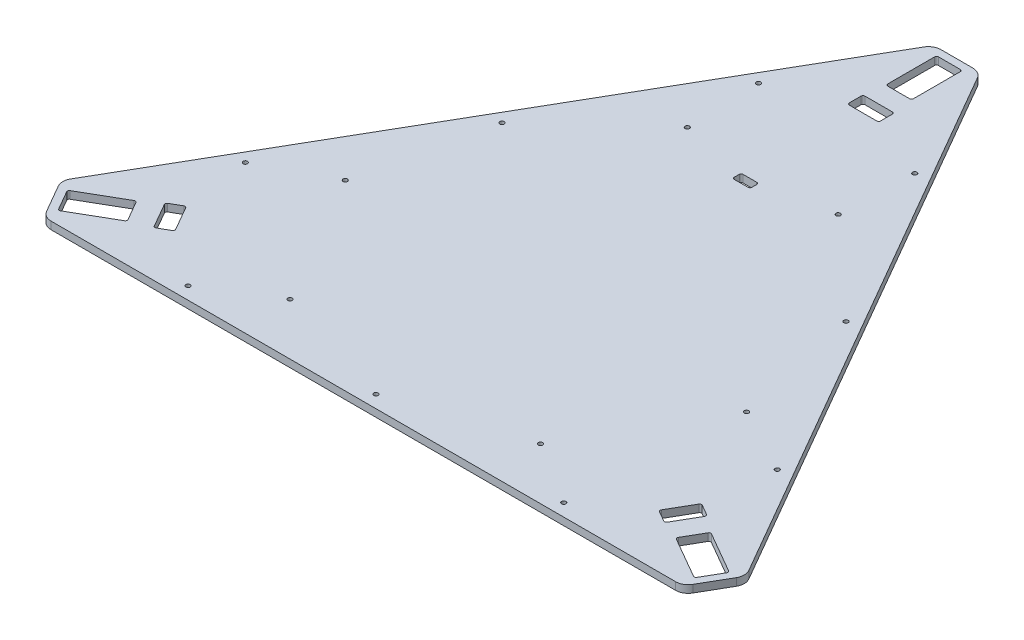
from build123d import *

# Parameters (mm, degrees)
SKETCH_1_W          = 20.5
SKETCH_1_H          = 40.5
SKETCH_1_W_2        = 25
SKETCH_1_H_2        = 12.5
SKETCH_1_W_3        = 14
SKETCH_1_H_3        = 7
EXTRUDE_1367_DEPTH  = 3
FILLET_1_R          = 10
FILLET_2_R          = 1.5
HOLE_WIZARD_3_5_D   = 3.5
HOLE_WIZARD_3_5_2_D = 3.5


with BuildPart() as part:
    # Эскиз1 → Extrude 1367 (new, symmetric)
    with BuildSketch(Plane(origin=(0, 0, 0), x_dir=(1, 0, 0), z_dir=(0, 1, 0))):
        Polygon((273.664027596, -136.63804004), (18.5, 305.31902002), (-18.5, 305.31902002), (-273.664027596, -136.63804004), (-255.164027596, -168.68097998), (255.164027596, -168.68097998), align=None)
        Polygon((219.01884632, -138.286270399), (254.092875173, -158.536270399), (264.342875173, -140.782749621), (229.26884632, -120.532749621), align=None, mode=Mode.SUBTRACT)
        with Locations((0, 279.06902002)):
            Rectangle(SKETCH_1_W, SKETCH_1_H, mode=Mode.SUBTRACT)
        Polygon((-229.26884632, -120.532749621), (-264.342875173, -140.782749621), (-254.092875173, -158.536270399), (-219.01884632, -138.286270399), align=None, mode=Mode.SUBTRACT)
        Polygon((216.537439859, -110.584192463), (204.037439859, -132.234827557), (193.212122312, -125.984827557), (205.712122312, -104.334192463), align=None, mode=Mode.SUBTRACT)
        with Locations((0, 236.56902002)):
            Rectangle(SKETCH_1_W_2, SKETCH_1_H_2, mode=Mode.SUBTRACT)
        Polygon((-204.037439859, -132.234827557), (-216.537439859, -110.584192463), (-205.712122312, -104.334192463), (-193.212122312, -125.984827557), align=None, mode=Mode.SUBTRACT)
        with Locations((0, 136.5)):
            Rectangle(SKETCH_1_W_3, SKETCH_1_H_3, mode=Mode.SUBTRACT)
    extrude(amount=EXTRUDE_1367_DEPTH, both=True)

    # Скругление1
    fillet_1_edges = [part.edges().sort_by_distance(p)[0] for p in [
        (255.164027596, 0, 168.68097998),
        (-255.164027596, 0, 168.68097998),
        (-273.664027596, 0, 136.63804004),
        (-18.5, 0, -305.31902002),
        (18.5, 0, -305.31902002),
        (273.664027596, 0, 136.63804004),
    ]]
    fillet(fillet_1_edges, radius=FILLET_1_R)

    # Скругление2
    fillet_2_edges = [part.edges().sort_by_distance(p)[0] for p in [
        (10.25, 0, -258.81902002),
        (10.25, 0, -299.31902002),
        (-10.25, 0, -299.31902002),
        (-10.25, 0, -258.81902002),
        (12.5, 0, -230.31902002),
        (12.5, 0, -242.81902002),
        (-12.5, 0, -242.81902002),
        (-12.5, 0, -230.31902002),
        (229.26884632, 0, 120.532749621),
        (219.01884632, 0, 138.286270399),
        (254.092875173, 0, 158.536270399),
        (264.342875173, 0, 140.782749621),
        (-219.01884632, 0, 138.286270399),
        (-229.26884632, 0, 120.532749621),
        (-264.342875173, 0, 140.782749621),
        (-254.092875173, 0, 158.536270399),
        (-7, 0, -140),
        (-7, 0, -133),
        (7, 0, -133),
        (7, 0, -140),
        (193.212122312, 0, 125.984827557),
        (204.037439859, 0, 132.234827557),
        (216.537439859, 0, 110.584192463),
        (205.712122312, 0, 104.334192463),
        (-205.712122312, 0, 104.334192463),
        (-216.537439859, 0, 110.584192463),
        (-204.037439859, 0, 132.234827557),
        (-193.212122312, 0, 125.984827557),
    ]]
    fillet(fillet_2_edges, radius=FILLET_2_R)

    # Hole Wizard 3_5 (through all)
    with Locations(Plane.XZ.offset(3)):
        with Locations((-100, 127.305734356), (-160.25, 22.9496732), (100, 127.305734356), (160.25, 22.9496732), (-60.25, -150.255407557), (60.25, -150.255407557)):
            Hole(HOLE_WIZARD_3_5_D / 2)

    # Hole Wizard 3_5 2 (through all)
    with Locations(Plane(origin=(0, 3, 0), x_dir=(1, 0, 0), z_dir=(0, 1, 0))):
        with Locations((-137.42175976, 79.34048999), (-62.42175976, 209.244300558), (62.42175976, 209.244300558), (137.42175976, 79.34048999), (212.42175976, -50.563320578), (150, -158.68097998), (0, -158.68097998), (-150, -158.68097998), (-212.42175976, -50.563320578)):
            Hole(HOLE_WIZARD_3_5_2_D / 2)


solid = part.part
